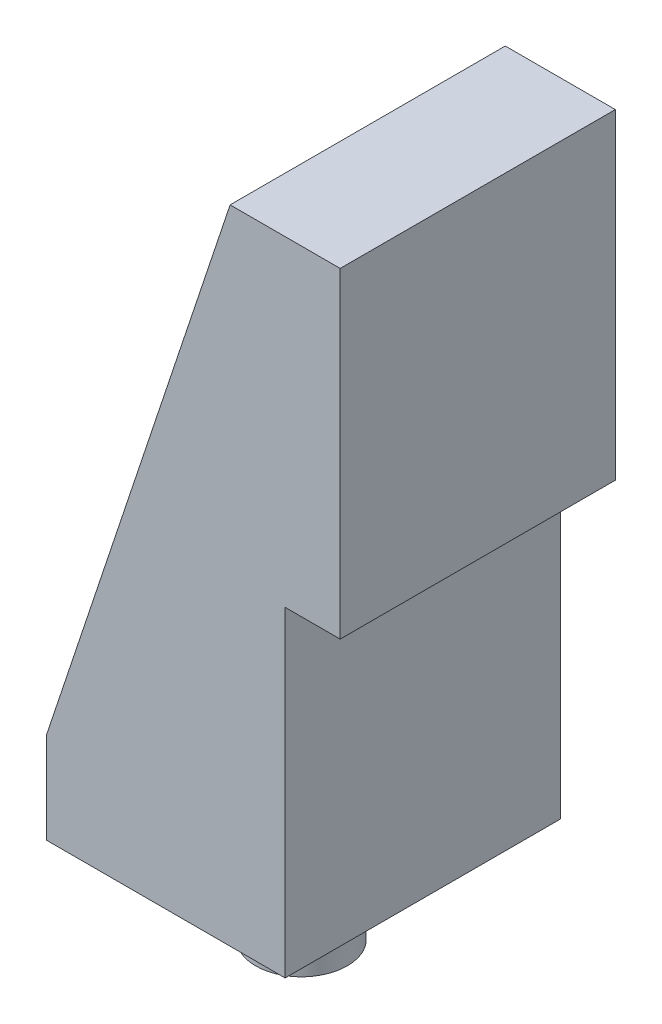
from build123d import *

# Parameters (mm, degrees)
BOSS_EXTRUDE1_DEPTH = 1.5
SKETCH2_R           = 0.25
BOSS_EXTRUDE2_DEPTH = 0.5


with BuildPart() as part:
    # Sketch1 → Boss-Extrude1 (new body)
    with BuildSketch(Plane.XY):
        Polygon((0, 0), (1.3, 0), (1.3, 1.75), (1.6, 1.75), (1.6, 3.5), (1.3, 3.5), (1, 3.5), (0, 0.5), align=None)
    extrude(amount=BOSS_EXTRUDE1_DEPTH)

    # Sketch2 → Boss-Extrude2 (add)
    with BuildSketch(Plane.XZ):
        with Locations(Location((0.662330501, 0.773316301, 0), (0, 0, 90))):
            Circle(SKETCH2_R)
    extrude(amount=BOSS_EXTRUDE2_DEPTH)


solid = part.part
